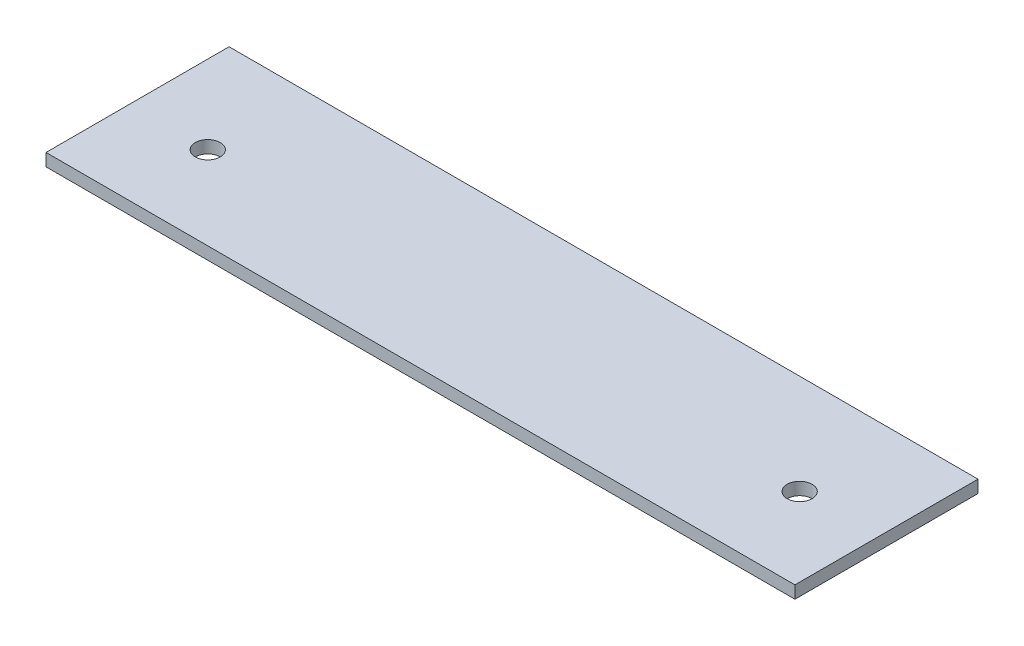
from build123d import *

# Parameters (mm, degrees)
SKETCH1_W           = 90
SKETCH1_H           = 22
SKETCH1_R           = 1.5
BOSS_EXTRUDE1_DEPTH = 1.5


with BuildPart() as part:
    # Sketch1 → Boss-Extrude1 (new body)
    with BuildSketch(Plane(origin=(0, 0, 0), x_dir=(1, 0, 0), z_dir=(0, 1, 0))):
        Rectangle(SKETCH1_W, SKETCH1_H)
        with Locations(Location((35.565, -1, 0), (0, 0, 270))):
            Circle(SKETCH1_R, mode=Mode.SUBTRACT)
        with Locations(Location((-35.565, -1, 0), (0, 0, 270))):
            Circle(SKETCH1_R, mode=Mode.SUBTRACT)
    extrude(amount=-BOSS_EXTRUDE1_DEPTH)


solid = part.part
